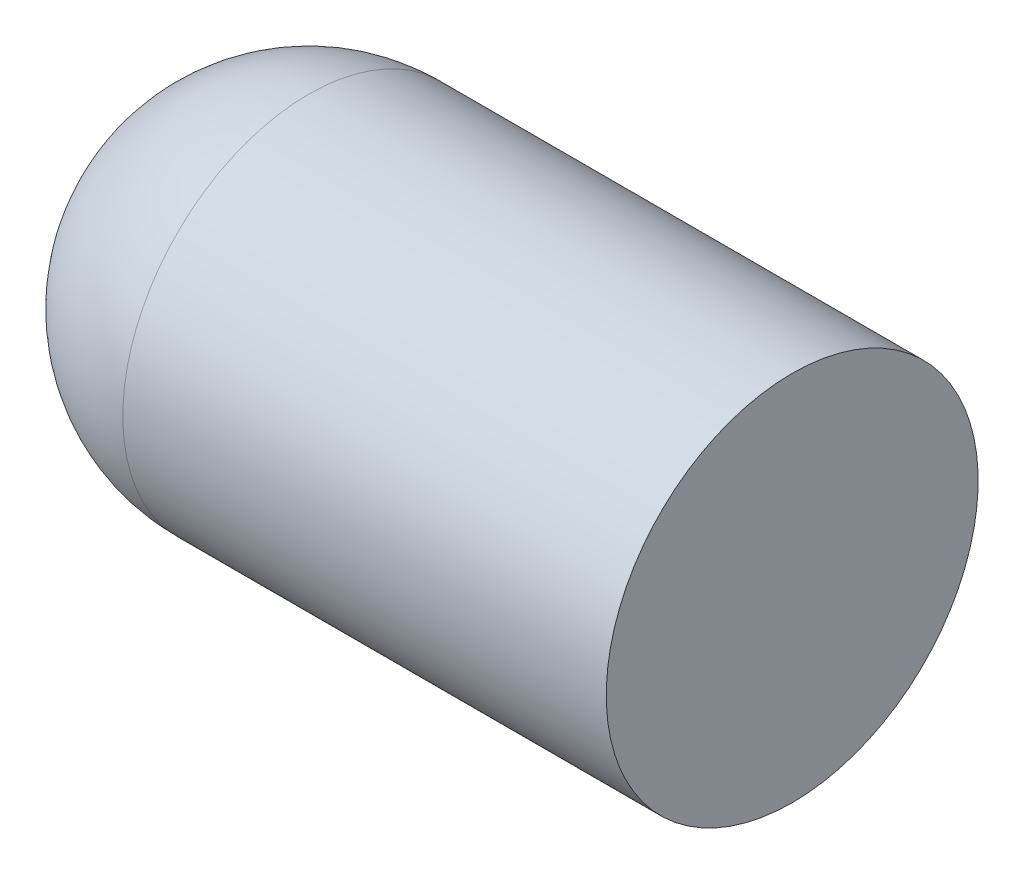
from build123d import *


with BuildPart() as part:
    # ｽｹｯﾁ1 → 回転1 (revolve)
    with BuildSketch(Plane.XY):
        with BuildLine():
            Line((0, 5), (13, 5))
            Line((13, 5), (13, 0))
            Line((13, 0), (-5, 0))
            ThreePointArc((-5, 0), (-3.535533906, 3.535533906), (0, 5))
        make_face()
    revolve(axis=Axis((13, 0, 0), (-1, 0, 0)))


solid = part.part
